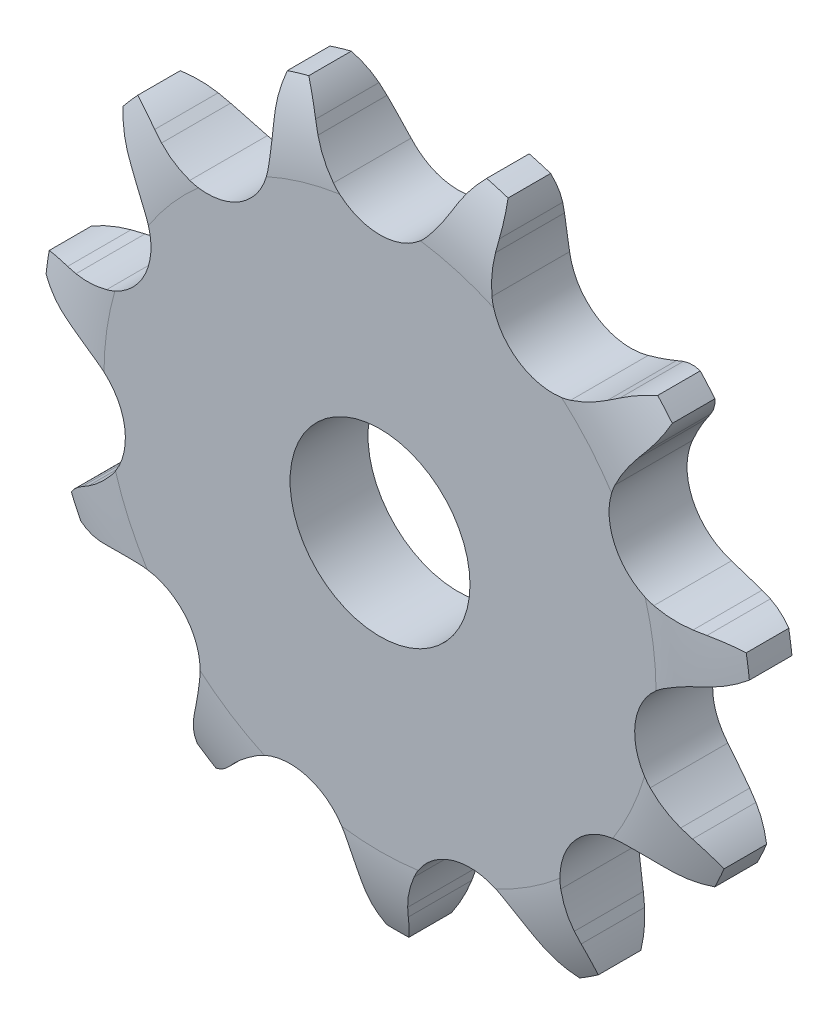
from build123d import *

# Parameters (mm, degrees)
CUT_EXTRUDE1_DEPTH      = 18.044340545
CIRPATTERN1_COUNT       = 11
BOSS_EXTRUDE1_START     = 1.3
SKETCH2_R               = 7
BOSS_EXTRUDE1_DEPTH     = 7.4
CUT_EXTRUDE2_DEPTH      = 20.035611816
CUT_EXTRUDE2_DEPTH_BACK = 20.035611816
SKETCH3_R               = 3
SKETCH4_W               = 1.95
SKETCH4_H               = 5.468665118
CUT_EXTRUDE3_DEPTH      = 20.035611816
CUT_EXTRUDE3_DEPTH_BACK = 20.035611816
SKETCH5_OUTSIDE_W       = 32.858
SKETCH5_OUTSIDE_H       = 32.618
SKETCH5_OUTSIDE_R       = 11.8
SKETCH6_R               = 8.084624089
CUT_EXTRUDE4_DEPTH      = 10


with BuildPart() as part:
    # Sketch1 → Revolve1 (revolve)
    with BuildSketch(Plane(origin=(0, 0, 0), x_dir=(0, 0, -1), z_dir=(1, 0, 0))):
        with BuildLine():
            Line((1.3, 0), (-1.3, 0))
            Line((-1.3, 0), (-1.3, 9.204589495))
            ThreePointArc((-1.3, 9.204589495), (-1.122370651, 10.653727169), (-0.6, 12.017061717))
            Line((-0.6, 12.017061717), (0.6, 12.017061717))
            ThreePointArc((0.6, 12.017061717), (1.122370651, 10.653727169), (1.3, 9.204589495))
            Line((1.3, 9.204589495), (1.3, 0))
        make_face()
    revolve(axis=Axis((0, 0, -1.3), (0, 0, 1)))

    # Sketch0 → Cut-Extrude1 (cut, symmetric)
    with BuildSketch(Plane.XY):
        with BuildLine():
            Line((5.286940007, -9.522958146), (5.029594326, -9.255621326))
            ThreePointArc((5.029594326, -9.255621326), (4.596478059, -8.853656804), (4.120920344, -8.502928935))
            ThreePointArc((4.120920344, -8.502928935), (2.42298355, -8.251924157), (1.130291652, -9.38105675))
            ThreePointArc((1.130291652, -9.38105675), (0.919844846, -9.93321372), (0.772802685, -10.505528127))
            Line((0.772802685, -10.505528127), (0.700842918, -10.869557751))
            ThreePointArc((0.700842918, -10.869557751), (-0.803525343, -13.062056242), (-3.429793972, -13.477852573))
            ThreePointArc((-3.429793972, -13.477852573), (3.918169609, -13.344060236), (10.172003529, -9.484004475))
            ThreePointArc((10.172003529, -9.484004475), (7.737849298, -10.554082362), (5.286940007, -9.522958146))
        make_face()
    cut_extrude1 = extrude(amount=CUT_EXTRUDE1_DEPTH, both=True, mode=Mode.SUBTRACT)

    # CirPattern1: Cut-Extrude1 ×11 about axis
    cirpattern1_axis = Axis((0, 0, 0), (0, 0, 1))
    for i in range(1, CIRPATTERN1_COUNT):
        add(cut_extrude1.rotate(cirpattern1_axis, i * 360 / CIRPATTERN1_COUNT), mode=Mode.SUBTRACT)

    # Sketch2 → Boss-Extrude1 (add)
    with BuildSketch(Plane.XY.offset(BOSS_EXTRUDE1_START)):
        with Locations(Location((0, 0, 0), (0, 0, 270))):
            Circle(SKETCH2_R)
    extrude(amount=BOSS_EXTRUDE1_DEPTH)

    # Sketch3 → Cut-Extrude2 (cut, two sides: drawn at the far end of the back side and taken through both)
    with BuildSketch(Plane.XY.offset(-CUT_EXTRUDE2_DEPTH_BACK)):
        Circle(SKETCH3_R)
    extrude(amount=CUT_EXTRUDE2_DEPTH + CUT_EXTRUDE2_DEPTH_BACK, mode=Mode.SUBTRACT)

    # Sketch4 → Cut-Revolve1 (revolve, cut)
    with BuildSketch(Plane(origin=(0, 0, 0), x_dir=(0, 0, -1), z_dir=(1, 0, 0))):
        Polygon((-8.7, 7), (-8.7, 6.5), (-8.2, 7), align=None)
        with Locations((-2.275, 9.282729158)):
            Rectangle(SKETCH4_W, SKETCH4_H)
    revolve(axis=Axis((0, 0, -1.3), (0, 0, 1)), mode=Mode.SUBTRACT)

    # Sketch5 outside → Cut-Extrude3 (cut, two sides: drawn at the far end of the back side and taken through both)
    with BuildSketch(Plane.XY.offset(-CUT_EXTRUDE3_DEPTH_BACK)):
        with Locations((0, -0.21)):
            Rectangle(SKETCH5_OUTSIDE_W, SKETCH5_OUTSIDE_H)
        Circle(SKETCH5_OUTSIDE_R, mode=Mode.SUBTRACT)
    extrude(amount=CUT_EXTRUDE3_DEPTH + CUT_EXTRUDE3_DEPTH_BACK, mode=Mode.SUBTRACT)

    # Sketch6 → Cut-Extrude4 (cut)
    with BuildSketch(Plane.XY.offset(1.3)):
        Circle(SKETCH6_R)
    extrude(amount=CUT_EXTRUDE4_DEPTH, mode=Mode.SUBTRACT)


solid = part.part
